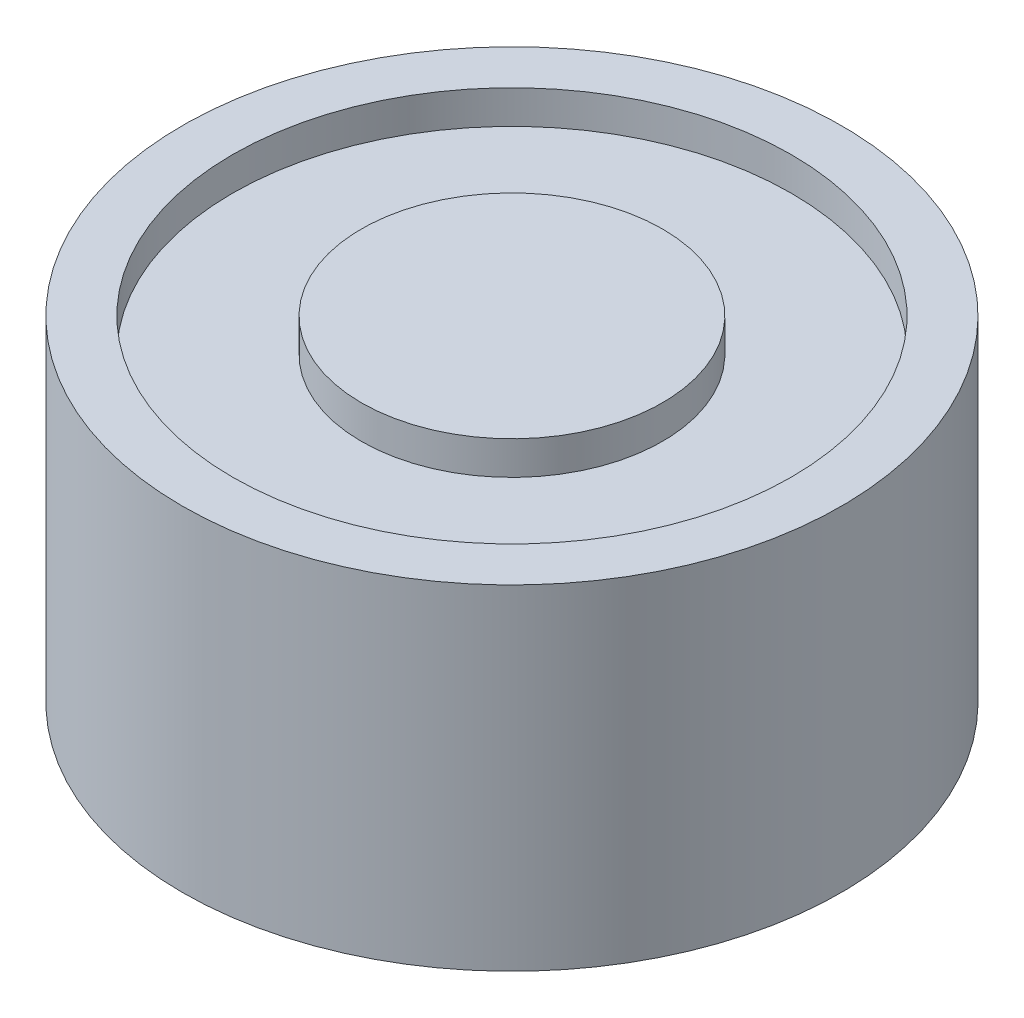
from build123d import *

# Parameters (mm, degrees)
SKETCH1_R           = 19.7
BOSS_EXTRUDE1_DEPTH = 20
SKETCH2_R           = 16.7
SKETCH2_R_2         = 9
CUT_EXTRUDE1_DEPTH  = 2


with BuildPart() as part:
    # Sketch1 → Boss-Extrude1 (new body)
    with BuildSketch(Plane(origin=(0, 0, 0), x_dir=(1, 0, 0), z_dir=(0, 1, 0))):
        with Locations(Location((0, 0, 0), (0, 0, 270))):
            Circle(SKETCH1_R)
    extrude(amount=BOSS_EXTRUDE1_DEPTH)

    # Sketch2 → Cut-Extrude1 (cut)
    with BuildSketch(Plane(origin=(0, 20, 0), x_dir=(1, 0, 0), z_dir=(0, 1, 0))):
        with Locations(Location((0, 0, 0), (0, 0, 270))):
            Circle(SKETCH2_R)
        with Locations(Location((0, 0, 0), (0, 0, 270))):
            Circle(SKETCH2_R_2, mode=Mode.SUBTRACT)
    extrude(amount=-CUT_EXTRUDE1_DEPTH, mode=Mode.SUBTRACT)


solid = part.part
